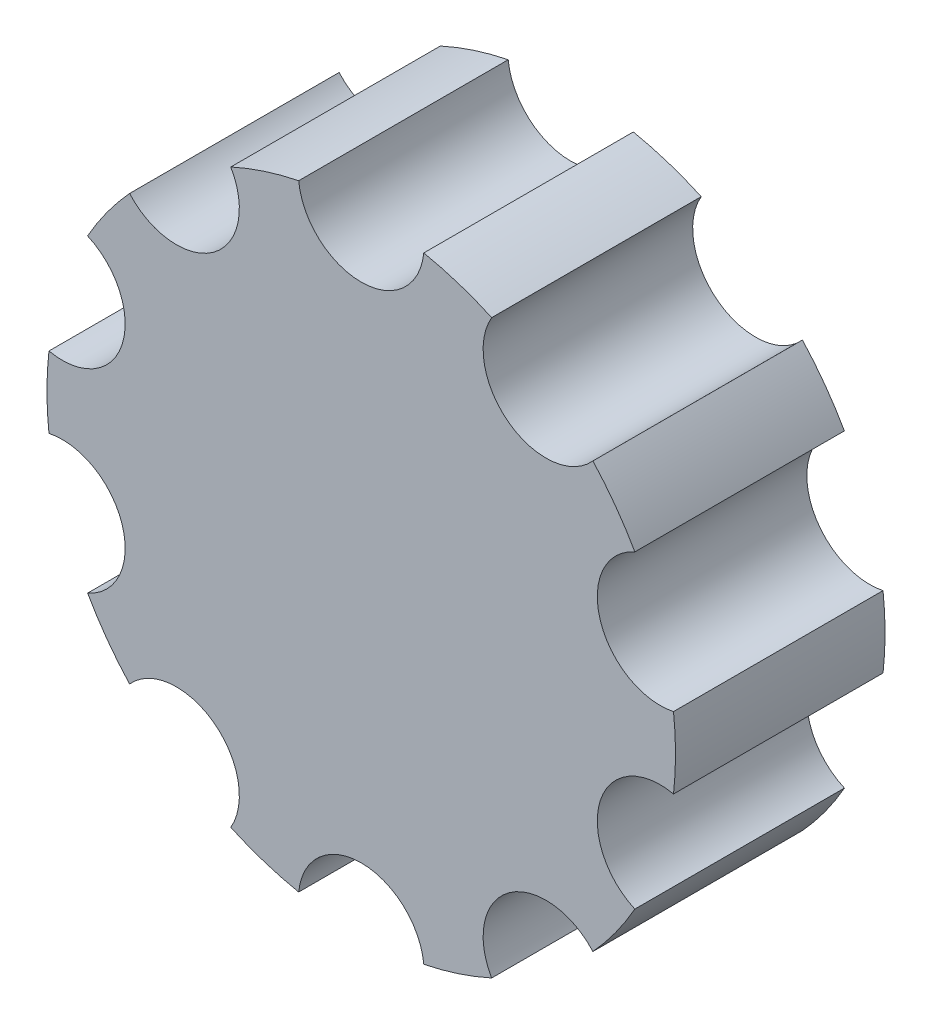
from build123d import *

# Parameters (mm, degrees)
SKETCH1_R           = 7.5
BOSS_EXTRUDE1_DEPTH = 5
SKETCH3_R           = 1.5
CUT_EXTRUDE1_DEPTH  = 5


with BuildPart() as part:
    # Sketch1 → Boss-Extrude1 (new body)
    with BuildSketch(Plane.XY):
        Circle(SKETCH1_R)
    extrude(amount=BOSS_EXTRUDE1_DEPTH)

    # Sketch3 → Cut-Extrude1 (cut)
    with BuildSketch(Plane.XY.offset(5)):
        with Locations((0, 7.5)):
            Circle(SKETCH3_R)
        with Locations((4.408389392, 6.067627458)):
            Circle(SKETCH3_R)
        with Locations((7.132923872, 2.317627458)):
            Circle(SKETCH3_R)
        with Locations((7.132923872, -2.317627458)):
            Circle(SKETCH3_R)
        with Locations((4.408389392, -6.067627458)):
            Circle(SKETCH3_R)
        with Locations((0, -7.5)):
            Circle(SKETCH3_R)
        with Locations((-4.408389392, -6.067627458)):
            Circle(SKETCH3_R)
        with Locations((-7.132923872, -2.317627458)):
            Circle(SKETCH3_R)
        with Locations((-7.132923872, 2.317627458)):
            Circle(SKETCH3_R)
        with Locations((-4.408389392, 6.067627458)):
            Circle(SKETCH3_R)
    extrude(amount=-CUT_EXTRUDE1_DEPTH, mode=Mode.SUBTRACT)


solid = part.part
